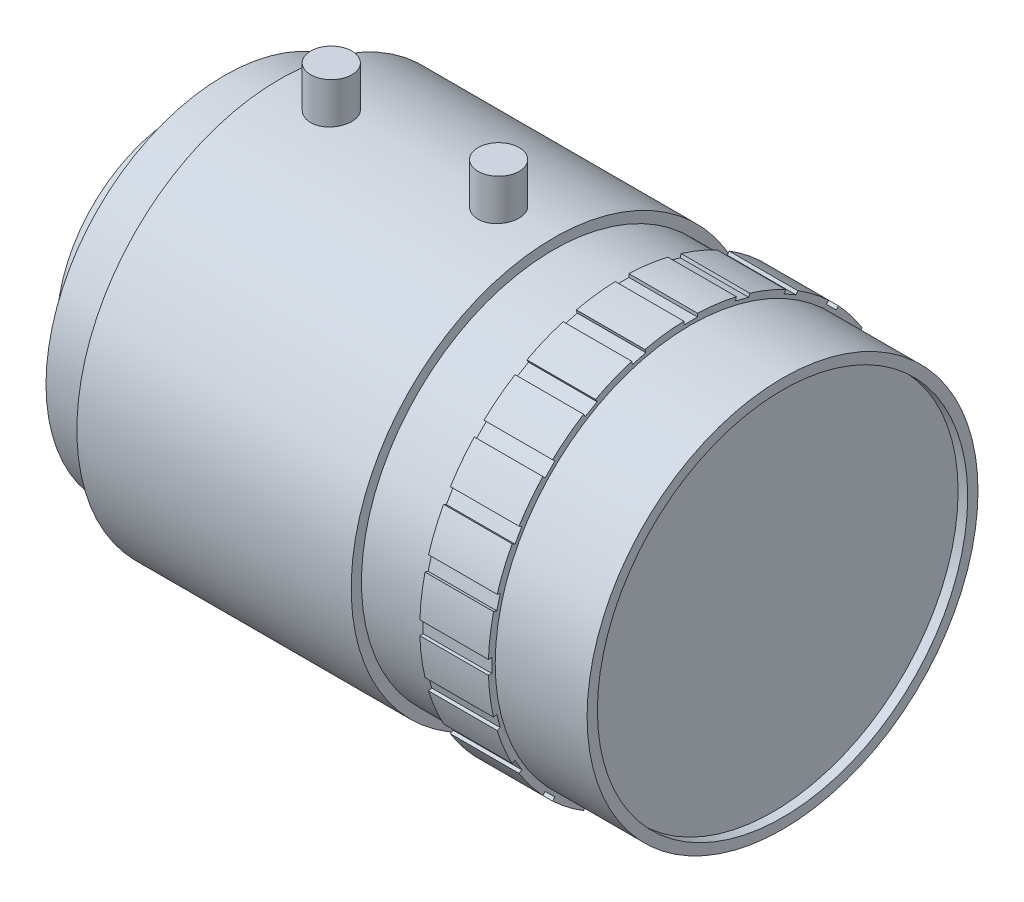
from build123d import *

# Parameters (mm, degrees)
SKETCH_1_R               = 14.75
EXTRUDE_1_DEPTH          = 20
SKETCH_2_R               = 14
EXTRUDE_2_DEPTH          = 5
SKETCH_3_R               = 14.75
EXTRUDE_3_DEPTH          = 5
SKETCH_4_R               = 14.25
SKETCH_4_R_2             = 13.5
EXTRUDE_4_DEPTH          = 6.7
SKETCH_5_R               = 13.5
EXTRUDE_5_DEPTH          = 6
SKETCH_6_W               = 1
SKETCH_6_H               = 10.048644724
CUT_EXTRUDE_1_DEPTH      = 15
PATTERN_CIRCULAR_1_COUNT = 24
SKETCH_7_R               = 1.5
EXTRUDE_6_DEPTH          = 17.7
SKETCH_8_R               = 10
EXTRUDE_7_DEPTH          = 1
SKETCH_9_R               = 13
EXTRUDE_8_DEPTH          = 3
SKETCH_10_R              = 8.9
EXTRUDE_9_DEPTH          = 3.3


with BuildPart() as part:
    # 草图1 → 凸台-拉伸1 (new body)
    with BuildSketch(Plane(origin=(0, 0, 0), x_dir=(0, 0, -1), z_dir=(1, 0, 0))):
        Circle(SKETCH_1_R)
    extrude(amount=EXTRUDE_1_DEPTH)

    # 草图2 → 凸台-拉伸2 (add)
    with BuildSketch(Plane(origin=(20, 0, 0), x_dir=(0, 0, -1), z_dir=(1, 0, 0))):
        Circle(SKETCH_2_R)
    extrude(amount=EXTRUDE_2_DEPTH)

    # 草图3 → 凸台-拉伸3 (add)
    with BuildSketch(Plane(origin=(25, 0, 0), x_dir=(0, 0, -1), z_dir=(1, 0, 0))):
        Circle(SKETCH_3_R)
    extrude(amount=EXTRUDE_3_DEPTH)

    # 草图4 → 凸台-拉伸4 (add)
    with BuildSketch(Plane(origin=(30, 0, 0), x_dir=(0, 0, -1), z_dir=(1, 0, 0))):
        Circle(SKETCH_4_R)
        Circle(SKETCH_4_R_2, mode=Mode.SUBTRACT)
    extrude(amount=EXTRUDE_4_DEPTH)

    # 草图5 → 凸台-拉伸5 (add)
    with BuildSketch(Plane(origin=(30, 0, 0), x_dir=(0, 0, -1), z_dir=(1, 0, 0))):
        Circle(SKETCH_5_R)
    extrude(amount=EXTRUDE_5_DEPTH)

    # 草图6 → 切除-拉伸1 (cut)
    with BuildSketch(Plane(origin=(36, 0, 0), x_dir=(0, 0, -1), z_dir=(1, 0, 0))):
        with Locations((0, 19.524322362)):
            Rectangle(SKETCH_6_W, SKETCH_6_H)
    cut_extrude_1 = extrude(amount=-CUT_EXTRUDE_1_DEPTH, mode=Mode.SUBTRACT)

    # 阵列(圆周)1: 切除-拉伸1 ×24 about axis
    pattern_circular_1_axis = Axis((0, 0, 0), (1, 0, 0))
    for i in range(1, PATTERN_CIRCULAR_1_COUNT):
        add(cut_extrude_1.rotate(pattern_circular_1_axis, i * 360 / PATTERN_CIRCULAR_1_COUNT), mode=Mode.SUBTRACT)

    # 草图7 → 凸台-拉伸6 (add)
    with BuildSketch(Plane(origin=(0, 0, 0), x_dir=(1, 0, 0), z_dir=(0, 1, 0))):
        with Locations(Location((3.8, 0, 0), (0, 0, 90))):
            Circle(SKETCH_7_R)
        with Locations(Location((16, 0, 0), (0, 0, 90))):
            Circle(SKETCH_7_R)
    extrude(amount=EXTRUDE_6_DEPTH)

    # 草图8 → 凸台-拉伸7 (add)
    with BuildSketch(Plane.ZY):
        Circle(SKETCH_8_R)
    extrude(amount=EXTRUDE_7_DEPTH)

    # 草图9 → 凸台-拉伸8 (add)
    with BuildSketch(Plane.ZY.offset(1)):
        Circle(SKETCH_9_R)
    extrude(amount=EXTRUDE_8_DEPTH)

    # 草图10 → 凸台-拉伸9 (add)
    with BuildSketch(Plane.ZY.offset(4)):
        Circle(SKETCH_10_R)
    extrude(amount=EXTRUDE_9_DEPTH)


solid = part.part
